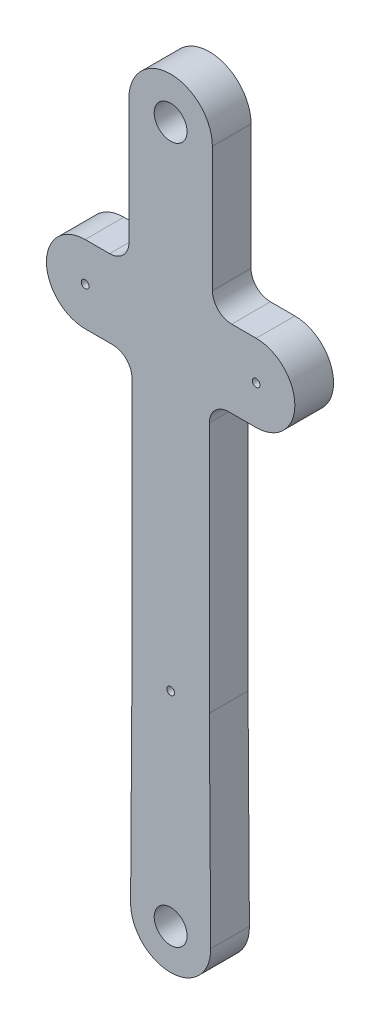
from build123d import *

# Parameters (mm, degrees)
SKETCH1_R           = 1
SKETCH1_R_2         = 4.25
BOSS_EXTRUDE1_DEPTH = 10
FILLET1_R           = 5


with BuildPart() as part:
    # Sketch1 → Boss-Extrude1 (new body)
    with BuildSketch(Plane.XY):
        with BuildLine():
            Line((-22.1, 10), (-10.782884141, 10))
            Line((-10.782884141, 10), (-10.782884141, 47.312260738))
            ThreePointArc((-10.782884141, 47.312260738), (0, 58.095144879), (10.782884141, 47.312260738))
            Line((10.782884141, 47.312260738), (10.782884141, 10))
            Line((10.782884141, 10), (22.1, 10))
            ThreePointArc((22.1, 10), (32.1, 0), (22.1, -10))
            Line((22.1, -10), (10, -10))
            Line((10, -10), (10, -80))
            Line((10, -80), (10.352856736, -132.530872001))
            ThreePointArc((10.352856736, -132.530872001), (0, -143.041784363), (-10.352856736, -132.530872001))
            Line((-10.352856736, -132.530872001), (-10, -80))
            Line((-10, -80), (-10, -10))
            Line((-10, -10), (-22.1, -10))
            ThreePointArc((-22.1, -10), (-32.1, 0), (-22.1, 10))
        make_face()
        with Locations((-22.1, 0)):
            Circle(SKETCH1_R, mode=Mode.SUBTRACT)
        with Locations((22.1, 0)):
            Circle(SKETCH1_R, mode=Mode.SUBTRACT)
        with Locations((0, -80)):
            Circle(SKETCH1_R, mode=Mode.SUBTRACT)
        with Locations((0, 47.312260738)):
            Circle(SKETCH1_R_2, mode=Mode.SUBTRACT)
        with Locations((0, -132.687739262)):
            Circle(SKETCH1_R_2, mode=Mode.SUBTRACT)
    extrude(amount=BOSS_EXTRUDE1_DEPTH)

    # Fillet1
    fillet1_edges = [part.edges().sort_by_distance(p)[0] for p in [
        (-10.782884141, 10, 5),
        (10.782884141, 10, 5),
        (10, -10, 5),
        (-10, -10, 5),
    ]]
    fillet(fillet1_edges, radius=FILLET1_R)


solid = part.part
